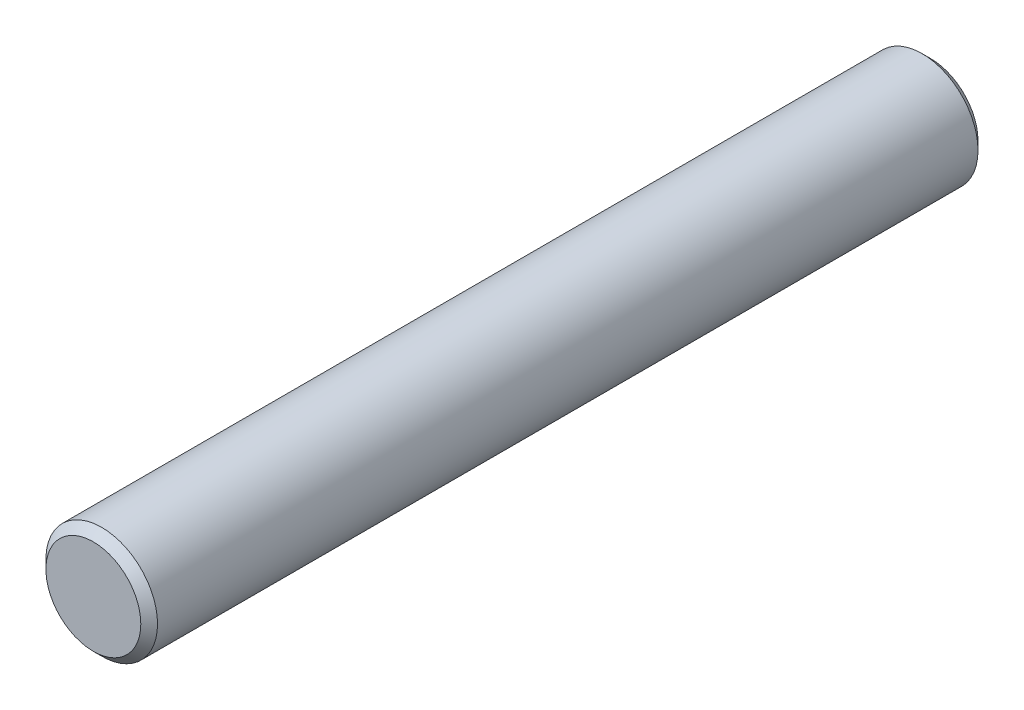
from build123d import *

# Parameters (mm, degrees)
SKETCH1_R           = 2
BOSS_EXTRUDE1_DEPTH = 30
CHAMFER1_SIZE       = 0.3


with BuildPart() as part:
    # Sketch1 → Boss-Extrude1 (new body)
    with BuildSketch(Plane.XY):
        Circle(SKETCH1_R)
    extrude(amount=BOSS_EXTRUDE1_DEPTH)

    # Chamfer1
    chamfer1_edges = [part.edges().sort_by_distance(p)[0] for p in [
        (-2, 0, 0),
        (-2, 0, 30),
    ]]
    chamfer(chamfer1_edges, length=CHAMFER1_SIZE)


solid = part.part
